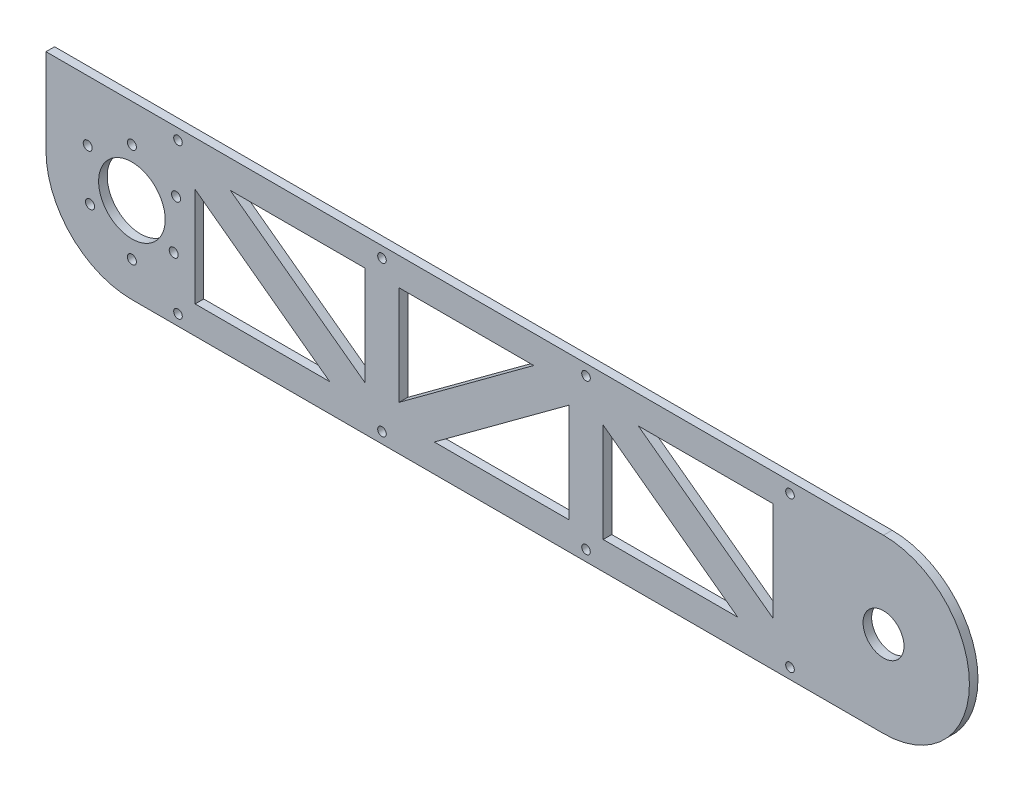
from build123d import *

# Parameters (mm, degrees)
SKETCH_1_R          = 2.1
SKETCH_1_R_2        = 15.5
SKETCH_1_R_3        = 9.53
EXTRUDE_1_DEPTH     = 4
SKETCH_2_R          = 2
CUT_EXTRUDE_1_DEPTH = 10
EXTRUDE_2_DEPTH     = 4


with BuildPart() as part:
    # 草图1 → 凸台-拉伸1 (new body)
    with BuildSketch(Plane.XY):
        with BuildLine():
            ThreePointArc((-1.457142857, 39.854285714), (-41.457142857, -0.145714286), (-1.457142857, -40.145714286))
            Line((-1.457142857, -40.145714286), (348.542857143, -40.145714286))
            ThreePointArc((348.542857143, -40.145714286), (388.542857143, -0.145714286), (348.542857143, 39.854285714))
            Line((348.542857143, 39.854285714), (14.042857143, 39.854285714))
            Line((14.042857143, 39.854285714), (-1.457142857, 39.854285714))
        make_face()
        with Locations((-1.457142857, -23.895714286)):
            Circle(SKETCH_1_R, mode=Mode.SUBTRACT)
        with Locations((-20.942714442, -11.395714286)):
            Circle(SKETCH_1_R, mode=Mode.SUBTRACT)
        with Locations((18.028428728, -11.395714286)):
            Circle(SKETCH_1_R, mode=Mode.SUBTRACT)
        with Locations((-1.457142857, -0.145714286)):
            Circle(SKETCH_1_R_2, mode=Mode.SUBTRACT)
        with Locations((348.542857143, -0.145714286)):
            Circle(SKETCH_1_R_3, mode=Mode.SUBTRACT)
        with Locations((-22.025246197, 11.729285714)):
            Circle(SKETCH_1_R, mode=Mode.SUBTRACT)
        with Locations((19.110960483, 11.729285714)):
            Circle(SKETCH_1_R, mode=Mode.SUBTRACT)
        with Locations((-1.457142857, 22.354285714)):
            Circle(SKETCH_1_R, mode=Mode.SUBTRACT)
    extrude(amount=EXTRUDE_1_DEPTH)

    # 草图2 → 切除-拉伸1 (cut)
    with BuildSketch(Plane(origin=(0, 0, 0), x_dir=(-1, 0, 0), z_dir=(0, 0, -1))):
        with Locations((-20, -35.145714286)):
            Circle(SKETCH_2_R)
        with Locations((-115, -35.145714286)):
            Circle(SKETCH_2_R)
        with Locations((-210, -35.145714286)):
            Circle(SKETCH_2_R)
        with Locations((-305, -35.145714286)):
            Circle(SKETCH_2_R)
        with Locations((-305, 34.854285714)):
            Circle(SKETCH_2_R)
        with Locations((-210, 34.854285714)):
            Circle(SKETCH_2_R)
        with Locations((-115, 34.854285714)):
            Circle(SKETCH_2_R)
        with Locations((-20, 34.854285714)):
            Circle(SKETCH_2_R)
        Polygon((-218, -27.145714286), (-280.656658604, -27.145714286), (-218, 19.022349949), align=None)
        Polygon((-234.343341396, 26.854285714), (-297, -19.31377852), (-297, 26.854285714), align=None)
        Polygon((-123, 26.854285714), (-123, -19.31377852), (-185.656658604, 26.854285714), align=None)
        Polygon((-202, -27.145714286), (-139.343341396, -27.145714286), (-202, 19.022349949), align=None)
        Polygon((-90.656658604, -27.145714286), (-28, 19.022349949), (-28, -27.145714286), align=None)
        Polygon((-107, -19.31377852), (-44.343341396, 26.854285714), (-107, 26.854285714), align=None)
    extrude(amount=-CUT_EXTRUDE_1_DEPTH, mode=Mode.SUBTRACT)

    # 草图3 → 凸台-拉伸2 (add)
    with BuildSketch(Plane(origin=(0, 0, 0), x_dir=(-1, 0, 0), z_dir=(0, 0, -1))):
        Polygon((1.457142857, 39.854285714), (35.608920787, 39.854285714), (41.457142857, 39.854285714), (41.457142857, -0.145714286), align=None)
    extrude(amount=-EXTRUDE_2_DEPTH)


solid = part.part
